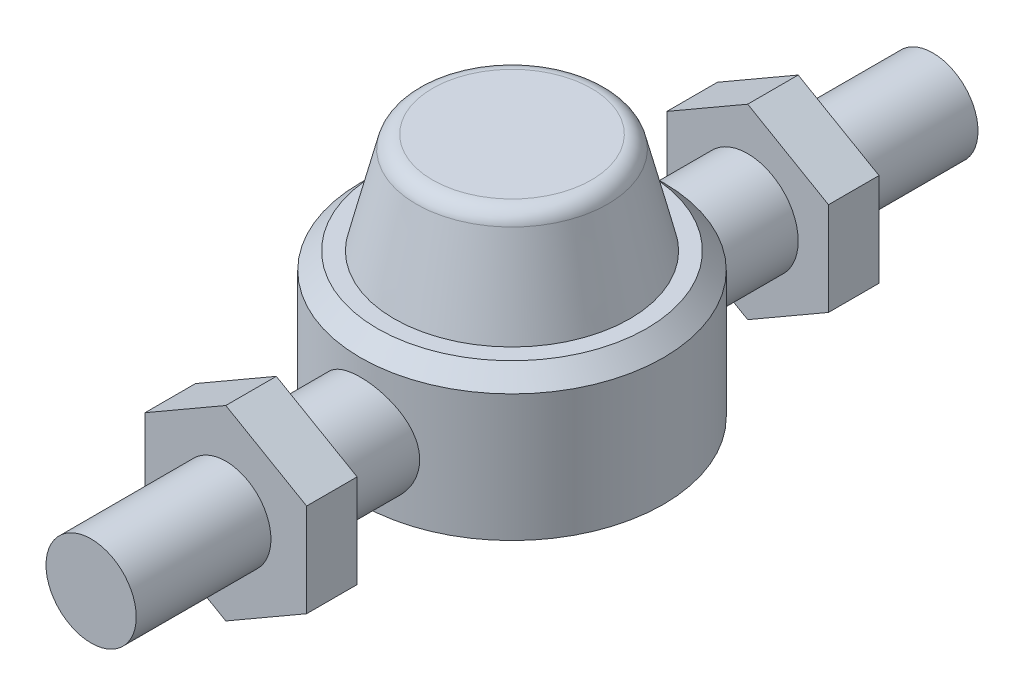
from build123d import *

# Parameters (mm, degrees)
EXTRUDE_324_DEPTH = 15
SKETCH_2_R        = 15
EXTRUDE_1_DEPTH   = 140
EXTRUDE_2_DEPTH   = 15
SKETCH_4_R        = 13.4
EXTRUDE_3_DEPTH   = 40
EXTRUDE_START     = 40
SKETCH_5_R        = 13.4
EXTRUDE_4_DEPTH   = 40
SKETCH_6_R        = 45
EXTRUDE_5_DEPTH   = 25
CHAMFER_1_SIZE    = 20
CHAMFER_1_SIZE2   = 7.279404685
CHAMFER_2_SIZE    = 5
SKETCH_7_R        = 27.5
SKETCH_8_R        = 35
FILLET_1_R        = 5


with BuildPart() as part:
    # Эскиз1 → Extrude 324 (new body)
    with BuildSketch(Plane.XY):
        Polygon((0, 27.712812921), (-24, 13.856406461), (-24, -13.856406461), (0, -27.712812921), (24, -13.856406461), (24, 13.856406461), align=None)
    extrude(amount=-EXTRUDE_324_DEPTH)

    # Эскиз2 → Бобышка-Вытянуть1 (add)
    with BuildSketch(Plane(origin=(0, 0, -15), x_dir=(-1, 0, 0), z_dir=(0, 0, -1))):
        Circle(SKETCH_2_R)
    extrude(amount=EXTRUDE_1_DEPTH)

    # Эскиз3 → Бобышка-Вытянуть2 (add)
    with BuildSketch(Plane(origin=(0, 0, -155), x_dir=(-1, 0, 0), z_dir=(0, 0, -1))):
        Polygon((0, 27.712812921), (-24, 13.856406461), (-24, -13.856406461), (0, -27.712812921), (24, -13.856406461), (24, 13.856406461), align=None)
    extrude(amount=EXTRUDE_2_DEPTH)

    # Эскиз4 → Бобышка-Вытянуть3 (add)
    with BuildSketch(Plane.XY):
        with Locations(Location((0, 0, 0), (0, 0, 180))):
            Circle(SKETCH_4_R)
    extrude(amount=EXTRUDE_3_DEPTH)

    # Эскиз5 → Бобышка-Вытянуть4 (add)
    with BuildSketch(Plane(origin=(0, 0, -170), x_dir=(-1, 0, 0), z_dir=(0, 0, -1)).offset(EXTRUDE_START)):
        Circle(SKETCH_5_R)
    extrude(amount=-EXTRUDE_4_DEPTH)

    # Эскиз6 → Бобышка-Вытянуть5 (add, symmetric)
    with BuildSketch(Plane(origin=(0, 0, 0), x_dir=(1, 0, 0), z_dir=(0, 1, 0))):
        with Locations(Location((0, 85, 0), (0, 0, 270))):
            Circle(SKETCH_6_R)
    extrude(amount=EXTRUDE_5_DEPTH, both=True)

    # Фаска1
    chamfer_1_edges = [part.edges().sort_by_distance(p)[0] for p in [
        (0, -25, -130),
    ]]
    chamfer_1_side = [part.faces().sort_by_distance(p)[0] for p in [
        (0, -25, -85),
    ]]
    chamfer(chamfer_1_edges, length=CHAMFER_1_SIZE, length2=CHAMFER_1_SIZE2, reference=chamfer_1_side[0])

    # Фаска2
    chamfer_2_edges = [part.edges().sort_by_distance(p)[0] for p in [
        (0, 25, -130),
    ]]
    chamfer(chamfer_2_edges, length=CHAMFER_2_SIZE)

    # Эскиз7 → Бобышка-По сечениям1 section 0
    with BuildSketch(Plane(origin=(0, 55, 0), x_dir=(-1, 0, 0), z_dir=(0, 1, 0))):
        with Locations((0, -85)):
            Circle(SKETCH_7_R)
    # Эскиз8 → Бобышка-По сечениям1 section 1
    with BuildSketch(Plane(origin=(0, 25, 0), x_dir=(-1, 0, 0), z_dir=(0, 1, 0))):
        with Locations((0, -85)):
            Circle(SKETCH_8_R)
    loft()

    # Скругление1
    fillet_1_edges = [part.edges().sort_by_distance(p)[0] for p in [
        (27.5, 55, -85),
    ]]
    fillet(fillet_1_edges, radius=FILLET_1_R)


solid = part.part
